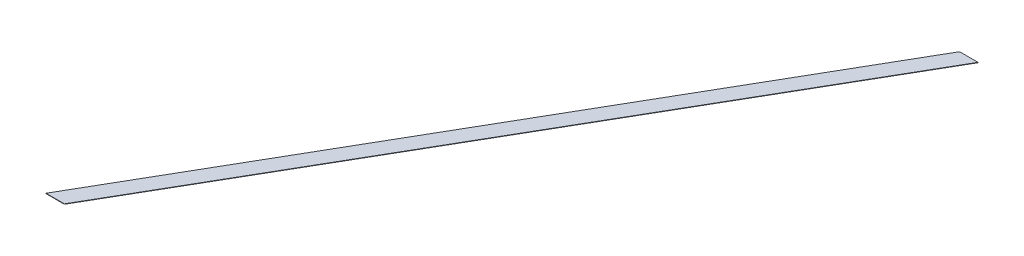
from build123d import *

# Parameters (mm, degrees)
BOSS_EXTRUDE1_DEPTH = 1.27


with BuildPart() as part:
    # Sketch1 → Boss-Extrude1 (new body)
    with BuildSketch(Plane(origin=(0, 0, 0), x_dir=(1, 0, 0), z_dir=(0, 1, 0))):
        Polygon((456.737314738, 893.39181696), (515.384286346, 893.39181696), (1581.725468702, 2741.83871696), (1523.078497094, 2741.83871696), align=None)
    extrude(amount=BOSS_EXTRUDE1_DEPTH)


solid = part.part
